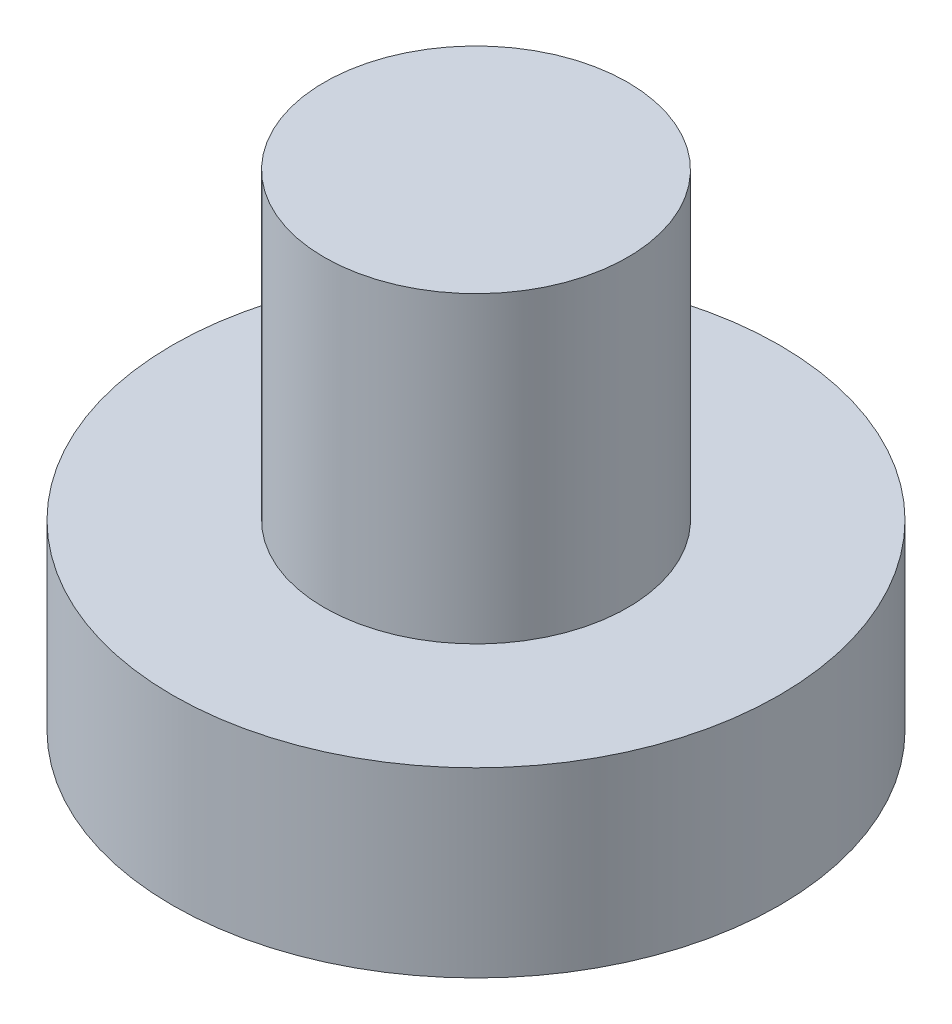
from build123d import *

# Parameters (mm, degrees)
SKETCH_1_R        = 50
EXTRUDE_207_DEPTH = 30
SKETCH_2_R        = 25
EXTRUDE_1_DEPTH   = 50


with BuildPart() as part:
    # Эскиз1 → Extrude 207 (new body)
    with BuildSketch(Plane(origin=(0, 0, 0), x_dir=(1, 0, 0), z_dir=(0, 1, 0))):
        with Locations(Location((0, 0, 0), (0, 0, 270))):
            Circle(SKETCH_1_R)
    extrude(amount=EXTRUDE_207_DEPTH)

    # Эскиз2 → Бобышка-Вытянуть1 (add)
    with BuildSketch(Plane(origin=(0, 30, 0), x_dir=(-1, 0, 0), z_dir=(0, 1, 0))):
        with Locations(Location((0, 0, 0), (0, 0, 90))):
            Circle(SKETCH_2_R)
    extrude(amount=EXTRUDE_1_DEPTH)


solid = part.part
